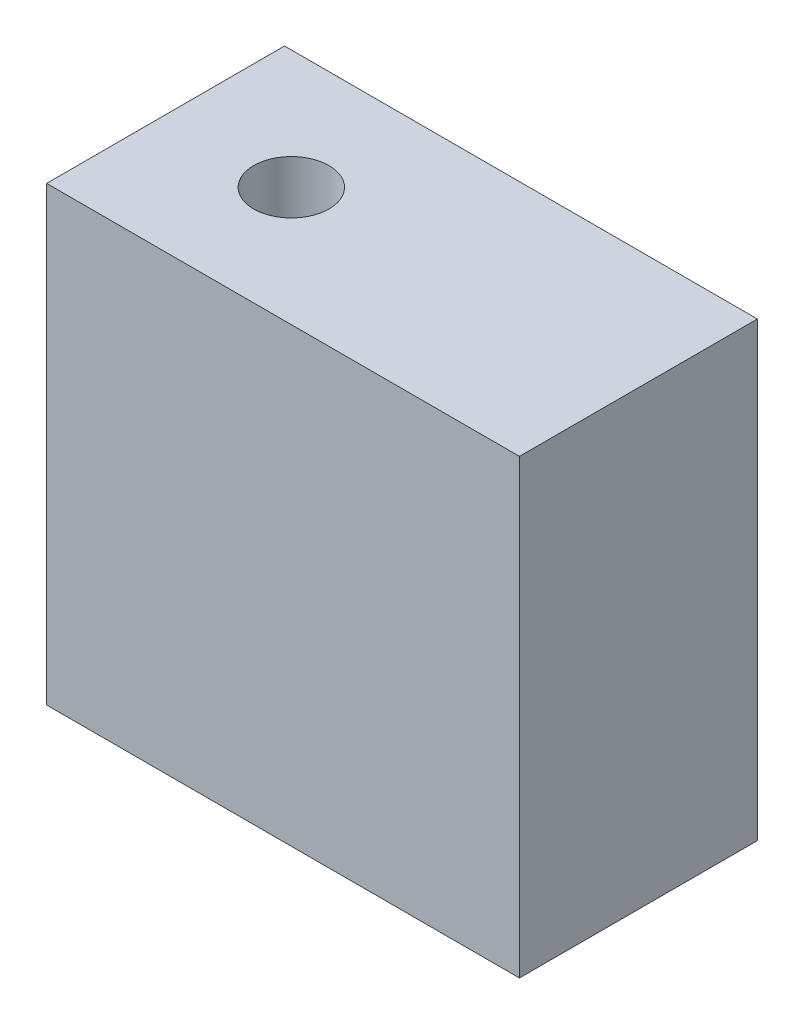
from build123d import *

# Parameters (mm, degrees)
SKETCH1_W           = 39.878
SKETCH1_H           = 20.066
BOSS_EXTRUDE1_DEPTH = 38.1
SKETCH2_R           = 3.175
CUT_EXTRUDE1_DEPTH  = 12.7


with BuildPart() as part:
    # Sketch1 → Boss-Extrude1 (new body)
    with BuildSketch(Plane(origin=(0, 0, 0), x_dir=(1, 0, 0), z_dir=(0, 1, 0))):
        with Locations((-19.939, -10.033)):
            Rectangle(SKETCH1_W, SKETCH1_H)
    extrude(amount=BOSS_EXTRUDE1_DEPTH)

    # Sketch2 → Cut-Extrude1 (cut)
    with BuildSketch(Plane(origin=(0, 38.1, 0), x_dir=(1, 0, 0), z_dir=(0, 1, 0))):
        with Locations(Location((-29.2735, -10.033, 0), (0, 0, 270))):
            Circle(SKETCH2_R)
    extrude(amount=-CUT_EXTRUDE1_DEPTH, mode=Mode.SUBTRACT)


solid = part.part
